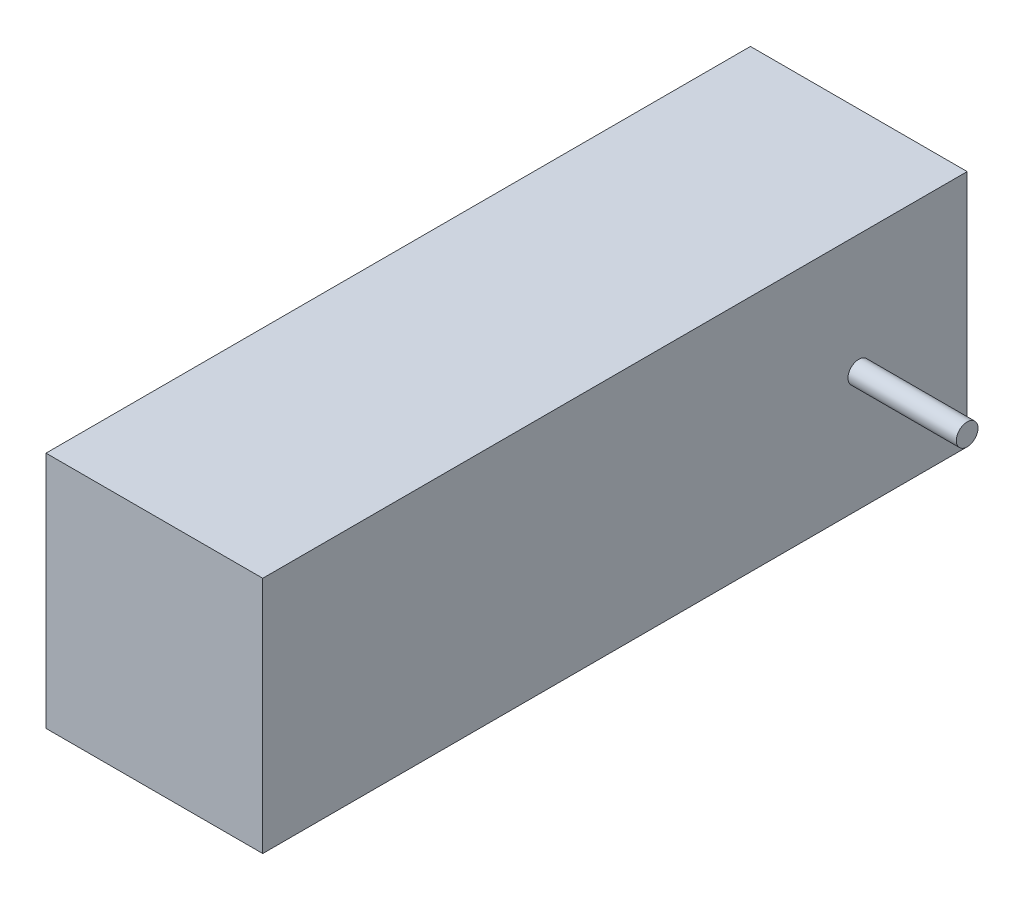
from build123d import *

# Parameters (mm, degrees)
SKETCH_1_W           = 20
SKETCH_1_H           = 22
EXTRUDE_1_DEPTH      = 65
EXTRUDE_2_DEPTH      = 10
EXTRUDE_2_DEPTH_BACK = 28
SKETCH_2_R           = 1


with BuildPart() as part:
    # 草圖1 → 填料-伸長1 (new body)
    with BuildSketch(Plane.XY):
        Rectangle(SKETCH_1_W, SKETCH_1_H)
    extrude(amount=EXTRUDE_1_DEPTH)

    # 草圖2 → 填料-伸長2 (add, two sides: drawn at the far end of the back side and taken through both)
    with BuildSketch(Plane(origin=(10, 0, 0), x_dir=(0, 0, -1), z_dir=(1, 0, 0)).offset(-EXTRUDE_2_DEPTH_BACK)):
        with Locations(Location((-10, 0, 0), (0, 0, 90))):
            Circle(SKETCH_2_R)
    extrude(amount=EXTRUDE_2_DEPTH + EXTRUDE_2_DEPTH_BACK)


solid = part.part
